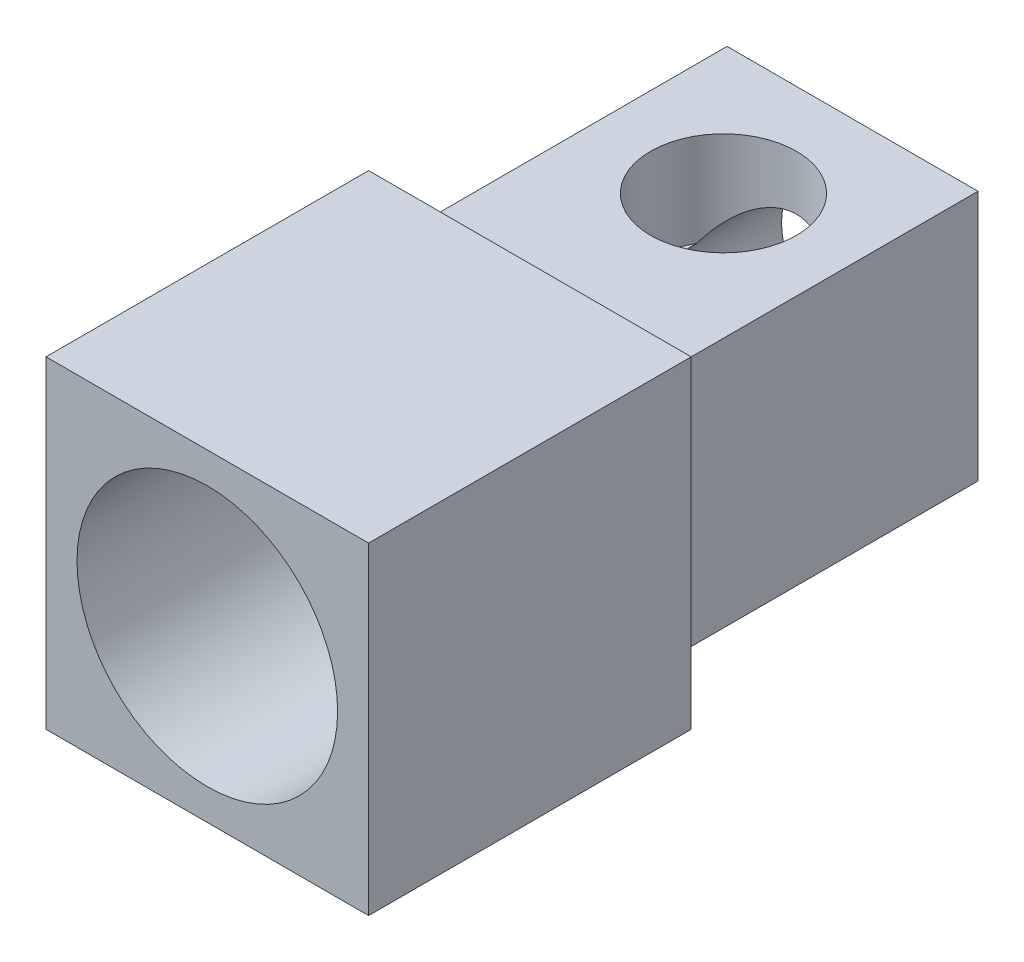
from build123d import *

# Parameters (mm, degrees)
SKETCH1_W                     = 5
SKETCH1_H                     = 5
BOSS_EXTRUDE1_DEPTH           = 10
HOLE_FOR_TUBING_R             = 1.1
CUT_EXTRUDE1_DEPTH            = 12.94095825
F_10_32_HOLE_FOR_LUER_SCREW_R = 2.0193
CUT_EXTRUDE2_DEPTH            = 4
F_4_40_SET_SCREW_HOLE_R       = 1.1303
CUT_EXTRUDE3_DEPTH            = 2
SKETCH2_W                     = 7.037684522
SKETCH2_H                     = 8.186757887
SKETCH2_W_2                   = 3.889087297
SKETCH2_H_2                   = 3.889087296
CUT_EXTRUDE4_DEPTH            = 5


with BuildPart() as part:
    # Sketch1 → Boss-Extrude1 (new body)
    with BuildSketch(Plane.XY):
        with Locations((-3.413043478, -0.260869565)):
            Rectangle(SKETCH1_W, SKETCH1_H)
    extrude(amount=BOSS_EXTRUDE1_DEPTH)

    # hole for tubing → Cut-Extrude1 (cut, through all)
    with BuildSketch(Plane(origin=(0, 0, 0), x_dir=(-1, 0, 0), z_dir=(0, 0, -1))):
        with Locations((3.413043478, -0.260869565)):
            Circle(HOLE_FOR_TUBING_R)
    extrude(amount=-CUT_EXTRUDE1_DEPTH, mode=Mode.SUBTRACT)

    # 10-32 hole for luer screw → Cut-Extrude2 (cut)
    with BuildSketch(Plane.XY.offset(10)):
        with Locations((-3.413043478, -0.260869565)):
            Circle(F_10_32_HOLE_FOR_LUER_SCREW_R)
    extrude(amount=-CUT_EXTRUDE2_DEPTH, mode=Mode.SUBTRACT)

    # 4-40 set screw hole → Cut-Extrude3 (cut)
    with BuildSketch(Plane(origin=(0, 2.239130435, 0), x_dir=(1, 0, 0), z_dir=(0, 1, 0))):
        with Locations(Location((-3.413043478, -2, 0), (0, 0, 180))):
            Circle(F_4_40_SET_SCREW_HOLE_R)
    extrude(amount=-CUT_EXTRUDE3_DEPTH, mode=Mode.SUBTRACT)

    # Sketch2 → Cut-Extrude4 (cut)
    with BuildSketch(Plane(origin=(0, 0, 0), x_dir=(-1, 0, 0), z_dir=(0, 0, -1))):
        with Locations((3.518842261, 0.133851948)):
            Rectangle(SKETCH2_W, SKETCH2_H)
        with Locations((3.413043479, -0.260869565)):
            Rectangle(SKETCH2_W_2, SKETCH2_H_2, mode=Mode.SUBTRACT)
    extrude(amount=-CUT_EXTRUDE4_DEPTH, mode=Mode.SUBTRACT)


solid = part.part
